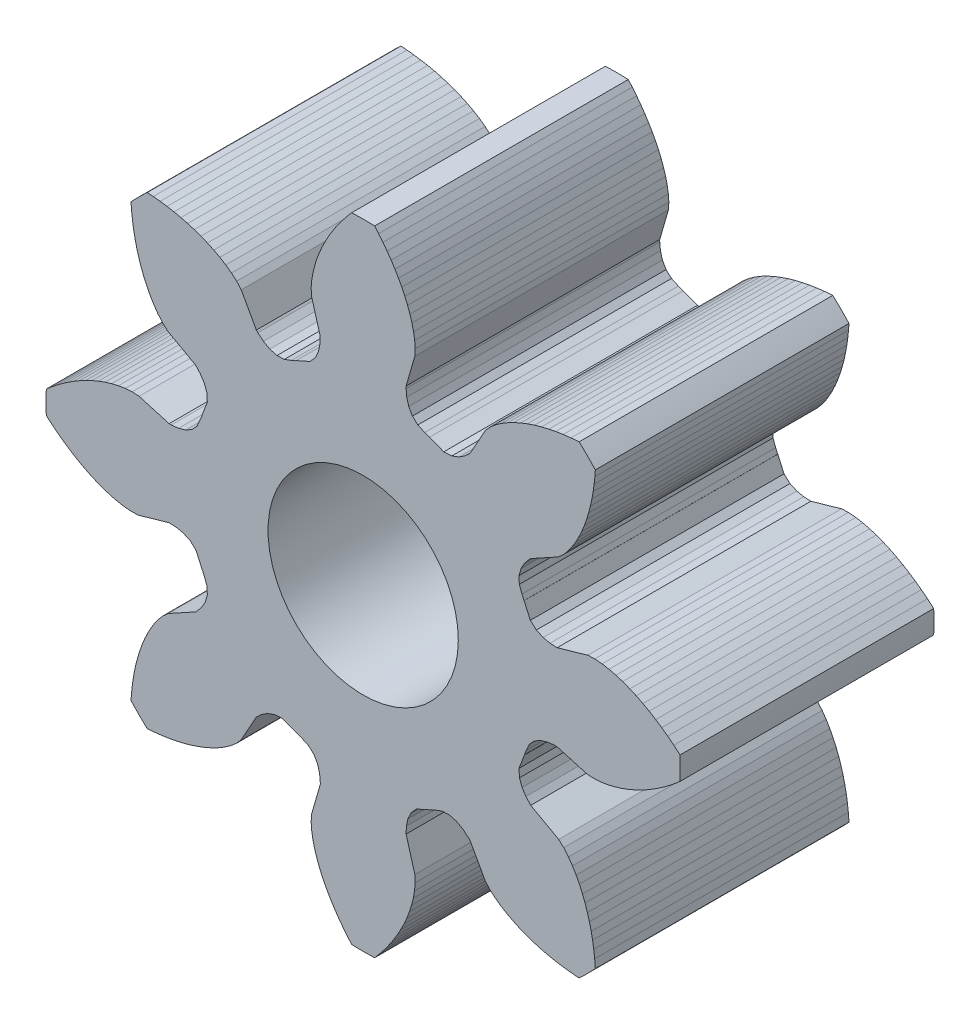
from build123d import *

# Parameters (mm, degrees)
BOSS_EXTRUDE1_DEPTH = 8
CIRPATTERN1_COUNT   = 8


with BuildPart() as part:
    # Model → Boss-Extrude1 (new body)
    with BuildSketch(Plane.XY):
        with BuildLine():
            Line((2.165294026, 5.05197791), (1.94176114, 5.142235828))
            Line((1.94176114, 5.142235828), (1.724259774, 5.240280464))
            Line((1.724259774, 5.240280464), (1.553544236, 5.397540621))
            Line((1.553544236, 5.397540621), (1.43785961, 5.601741174))
            Line((1.43785961, 5.601741174), (1.374883032, 5.823227149))
            Line((1.374883032, 5.823227149), (1.353135564, 6.050539162))
            Line((1.353135564, 6.050539162), (1.353324708, 6.118792638))
            Line((1.353324708, 6.118792638), (1.420264733, 6.350379502))
            Line((1.420264733, 6.350379502), (1.487204759, 6.581966367))
            Line((1.487204759, 6.581966367), (1.554144785, 6.813553231))
            Line((1.554144785, 6.813553231), (1.626986751, 7.06555855))
            Line((1.626986751, 7.06555855), (1.640620823, 7.284312582))
            Line((1.640620823, 7.284312582), (1.6246881, 7.501406288))
            Line((1.6246881, 7.501406288), (1.58927756, 7.718626485))
            Line((1.58927756, 7.718626485), (1.538214714, 7.933326596))
            Line((1.538214714, 7.933326596), (1.474931311, 8.141447763))
            Line((1.474931311, 8.141447763), (1.399957949, 8.346818785))
            Line((1.399957949, 8.346818785), (1.313396002, 8.551234419))
            Line((1.313396002, 8.551234419), (1.217465069, 8.75103575))
            Line((1.217465069, 8.75103575), (1.114710592, 8.943120849))
            Line((1.114710592, 8.943120849), (1.002719461, 9.133299578))
            Line((1.002719461, 9.133299578), (0.882629241, 9.320062592))
            Line((0.882629241, 9.320062592), (0.75568943, 9.502092754))
            Line((0.75568943, 9.502092754), (0.62323091, 9.678259661))
            Line((0.62323091, 9.678259661), (0.486638222, 9.847611336))
            Line((0.486638222, 9.847611336), (0.361410812, 9.993466977))
            ThreePointArc((0.361410812, 9.993466977), (-1e-09, 10), (-0.361410814, 9.993466977))
            Line((-0.361410814, 9.993466977), (-0.529171049, 9.7960975))
            Line((-0.529171049, 9.7960975), (-0.681060128, 9.60291623))
            Line((-0.681060128, 9.60291623), (-0.819359297, 9.412567938))
            Line((-0.819359297, 9.412567938), (-0.944511601, 9.225793815))
            Line((-0.944511601, 9.225793815), (-1.070046938, 9.019992158))
            Line((-1.070046938, 9.019992158), (-1.180574321, 8.822253245))
            Line((-1.180574321, 8.822253245), (-1.286239781, 8.61021151))
            Line((-1.286239781, 8.61021151), (-1.375142709, 8.408349006))
            Line((-1.375142709, 8.408349006), (-1.461420587, 8.181063922))
            Line((-1.461420587, 8.181063922), (-1.527544357, 7.971673452))
            Line((-1.527544357, 7.971673452), (-1.582344479, 7.751970674))
            Line((-1.582344479, 7.751970674), (-1.620280569, 7.535712748))
            Line((-1.620280569, 7.535712748), (-1.640154807, 7.302999701))
            Line((-1.640154807, 7.302999701), (-1.630641864, 7.08614879))
            Line((-1.630641864, 7.08614879), (-1.56420971, 6.854415729))
            Line((-1.56420971, 6.854415729), (-1.497777555, 6.622682668))
            Line((-1.497777555, 6.622682668), (-1.431345401, 6.390949607))
            Line((-1.431345401, 6.390949607), (-1.364913246, 6.159216545))
            Line((-1.364913246, 6.159216545), (-1.353324709, 6.118792638))
            Line((-1.353324709, 6.118792638), (-1.364079739, 5.894216357))
            Line((-1.364079739, 5.894216357), (-1.410696494, 5.677361659))
            Line((-1.410696494, 5.677361659), (-1.508555127, 5.462176539))
            Line((-1.508555127, 5.462176539), (-1.677749691, 5.272848732))
            Line((-1.677749691, 5.272848732), (-1.897839725, 5.174493154))
            Line((-1.897839725, 5.174493154), (-2.117929759, 5.076137576))
            Line((-2.117929759, 5.076137576), (-1.155180968, 2.768674219))
            ThreePointArc((-1.155180968, 2.768674219), (0.01446814, 2.999965112), (1.181831966, 2.757403344))
            Line((1.181831966, 2.757403344), (2.165294026, 5.05197791))
        make_face()
    boss_extrude1 = extrude(amount=BOSS_EXTRUDE1_DEPTH)

    # CirPattern1: Boss-Extrude1 ×8 about axis
    cirpattern1_axis = Axis((0, 0, -0.4), (0, 0, 1))
    for i in range(1, CIRPATTERN1_COUNT):
        add(boss_extrude1.rotate(cirpattern1_axis, i * 360 / CIRPATTERN1_COUNT))


solid = part.part
